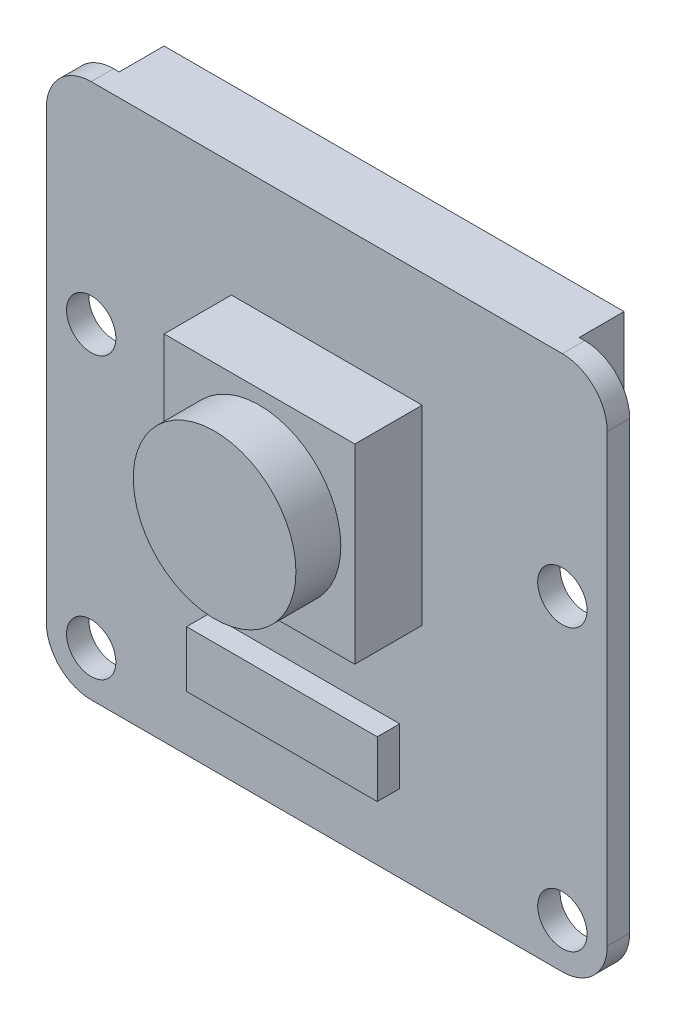
from build123d import *

# Parameters (mm, degrees)
SKETCH1_W           = 25
SKETCH1_H           = 23.862
BOSS_EXTRUDE1_DEPTH = 1
FILLET1_R           = 2
SKETCH2_R           = 1.1
CUT_EXTRUDE1_DEPTH  = 1
SKETCH3_W           = 8.5
SKETCH3_H           = 2.5
SKETCH3_H_2         = 8.5
BOSS_EXTRUDE2_DEPTH = 1
SKETCH4_W           = 8.5
SKETCH4_H           = 8.5
BOSS_EXTRUDE3_DEPTH = 2
SKETCH5_R           = 3.625
BOSS_EXTRUDE4_DEPTH = 2
SKETCH6_W           = 20.5
SKETCH6_H           = 5.5
BOSS_EXTRUDE5_DEPTH = 2


with BuildPart() as part:
    # Sketch1 → Boss-Extrude1 (new body)
    with BuildSketch(Plane.XY):
        Rectangle(SKETCH1_W, SKETCH1_H)
    extrude(amount=BOSS_EXTRUDE1_DEPTH)

    # Fillet1
    fillet1_edges = [part.edges().sort_by_distance(p)[0] for p in [
        (12.5, -11.931, 0.5),
        (-12.5, -11.931, 0.5),
        (-12.5, 11.931, 0.5),
        (12.5, 11.931, 0.5),
    ]]
    fillet(fillet1_edges, radius=FILLET1_R)

    # Sketch2 → Cut-Extrude1 (cut)
    with BuildSketch(Plane.XY.offset(1)):
        with Locations((-10.5, -9.931)):
            Circle(SKETCH2_R)
        with Locations((10.5, -9.931)):
            Circle(SKETCH2_R)
        with Locations((10.5, 2.569)):
            Circle(SKETCH2_R)
        with Locations((-10.5, 2.569)):
            Circle(SKETCH2_R)
    extrude(amount=-CUT_EXTRUDE1_DEPTH, mode=Mode.SUBTRACT)

    # Sketch3 → Boss-Extrude2 (add)
    with BuildSketch(Plane.XY.offset(1)):
        with Locations((-1, -7.231)):
            Rectangle(SKETCH3_W, SKETCH3_H)
        with Locations((0, 2.569)):
            Rectangle(SKETCH3_W, SKETCH3_H_2)
    extrude(amount=BOSS_EXTRUDE2_DEPTH)

    # Sketch4 → Boss-Extrude3 (add)
    with BuildSketch(Plane.XY.offset(2)):
        with Locations((0, 2.569)):
            Rectangle(SKETCH4_W, SKETCH4_H)
    extrude(amount=BOSS_EXTRUDE3_DEPTH)

    # Sketch5 → Boss-Extrude4 (add)
    with BuildSketch(Plane.XY.offset(4)):
        with Locations((0, 2.569)):
            Circle(SKETCH5_R)
    extrude(amount=BOSS_EXTRUDE4_DEPTH)

    # Sketch6 → Boss-Extrude5 (add)
    with BuildSketch(Plane(origin=(0, 0, 0), x_dir=(-1, 0, 0), z_dir=(0, 0, -1))):
        with Locations((0, 9.181)):
            Rectangle(SKETCH6_W, SKETCH6_H)
    extrude(amount=BOSS_EXTRUDE5_DEPTH)


solid = part.part
